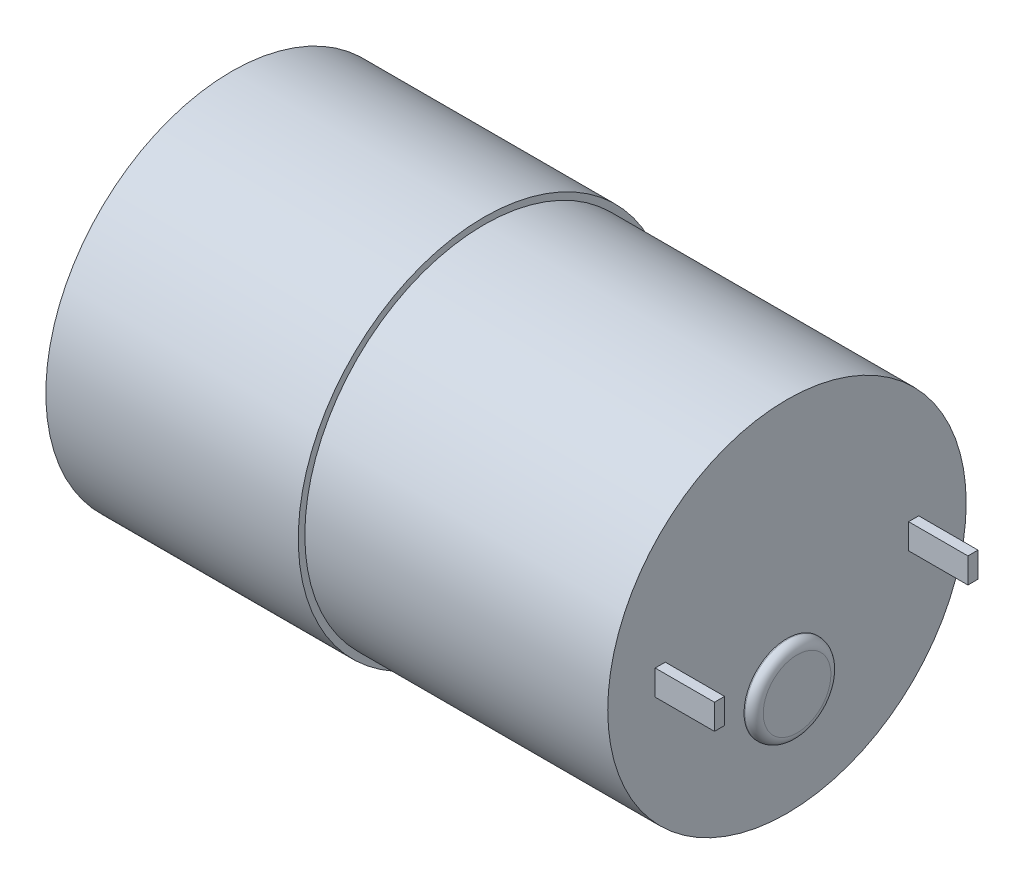
from build123d import *

# Parameters (mm, degrees)
SKETCH2_R                      = 4.25
BOSS_EXTRUDE1_DEPTH            = 1
FILLET1_R                      = 0.9
CHAMFER1_SIZE                  = 1.65
M3X0_5_TAPPED_HOLE2_AT_2_COUNT = 2
M3X0_5_TAPPED_HOLE2_AT_2_PITCH = 15.5
M3X0_5_TAPPED_HOLE2_AT_3_COUNT = 2
M3X0_5_TAPPED_HOLE2_AT_3_PITCH = 21.920310217
M3X0_5_TAPPED_HOLE2_AT_4_COUNT = 2
M3X0_5_TAPPED_HOLE2_AT_4_PITCH = 26.846787517
M3X0_5_TAPPED_HOLE2_AT_5_COUNT = 2
M3X0_5_TAPPED_HOLE2_AT_5_PITCH = 31
M3X0_5_TAPPED_HOLE2_AT_6_COUNT = 2
M3X0_5_TAPPED_HOLE2_AT_6_PITCH = 29.943700615
M3X0_5_TAPPED_HOLE2_AT_7_COUNT = 2
M3X0_5_TAPPED_HOLE2_AT_7_PITCH = 26.846787517
M3X0_5_TAPPED_HOLE2_AT_8_COUNT = 2
M3X0_5_TAPPED_HOLE2_AT_8_PITCH = 15.5
M3X0_5_TAPPED_HOLE2_AT_9_COUNT = 2
M3X0_5_TAPPED_HOLE2_AT_9_PITCH = 8.023390398
CUT_EXTRUDE3_DEPTH             = 1
SKETCH12_W                     = 1
SKETCH12_H                     = 2.5
BOSS_EXTRUDE3_DEPTH            = 5.87


with BuildPart() as part:
    # Sketch1 → Revolve1 (revolve)
    with BuildSketch(Plane.XY, mode=Mode.PRIVATE) as revolve1_sk:
        Polygon((30, 0), (30, 17.75), (0, 17.75), (0, 18.4), (-25, 18.4), (-25, 0), align=None)
    revolve(revolve1_sk.sketch.rotate(Axis((-25, 0, 0), (1, 0, 0)), 180), axis=Axis((-25, 0, 0), (1, 0, 0)))

    # Sketch2 → Boss-Extrude1 (add)
    with BuildSketch(Plane(origin=(30, 0, 0), x_dir=(0, 0, -1), z_dir=(1, 0, 0))):
        with Locations(Location((0, -7, 0), (0, 0, 270))):
            Circle(SKETCH2_R)
    extrude(amount=BOSS_EXTRUDE1_DEPTH)

    # Fillet1
    fillet1_edges = [part.edges().sort_by_distance(p)[0] for p in [
        (31, -2.75, 0),
    ]]
    fillet(fillet1_edges, radius=FILLET1_R)

    # Sketch11 → M3x0.5 Tapped Hole2 (revolve, cut)
    with BuildSketch(Plane(origin=(-25, 0, -15.5), x_dir=(0, 0, 1), z_dir=(0, 1, 0))):
        Polygon((0, 0), (0, 1.751075774), (1.25, 1), (1.25, 0), align=None)
    m3x0_5_tapped_hole2 = revolve(axis=Axis((-31.35, 0, -15.5), (1, 0, 0)), mode=Mode.SUBTRACT)

    # M3x0.5 Tapped Hole2 at 2: M3x0.5 Tapped Hole2 ×2
    with Locations(*[Vector(0, 0.8660254037844387, 0.5000000000000001) * (i * M3X0_5_TAPPED_HOLE2_AT_2_PITCH) for i in range(1, M3X0_5_TAPPED_HOLE2_AT_2_COUNT)]):
        add(m3x0_5_tapped_hole2, mode=Mode.SUBTRACT)

    # M3x0.5 Tapped Hole2 at 3: M3x0.5 Tapped Hole2 ×2
    with Locations(*[Vector(0, 0.7071067811865476, 0.7071067811865475) * (i * M3X0_5_TAPPED_HOLE2_AT_3_PITCH) for i in range(1, M3X0_5_TAPPED_HOLE2_AT_3_COUNT)]):
        add(m3x0_5_tapped_hole2, mode=Mode.SUBTRACT)

    # M3x0.5 Tapped Hole2 at 4: M3x0.5 Tapped Hole2 ×2
    with Locations(*[Vector(0, 0.5000000000000182, 0.8660254037844283) * (i * M3X0_5_TAPPED_HOLE2_AT_4_PITCH) for i in range(1, M3X0_5_TAPPED_HOLE2_AT_4_COUNT)]):
        add(m3x0_5_tapped_hole2, mode=Mode.SUBTRACT)

    # M3x0.5 Tapped Hole2 at 5: M3x0.5 Tapped Hole2 ×2
    with Locations(*[(0, 0, i * M3X0_5_TAPPED_HOLE2_AT_5_PITCH) for i in range(1, M3X0_5_TAPPED_HOLE2_AT_5_COUNT)]):
        add(m3x0_5_tapped_hole2, mode=Mode.SUBTRACT)

    # M3x0.5 Tapped Hole2 at 6: M3x0.5 Tapped Hole2 ×2
    with Locations(*[Vector(0, -0.25881904510249465, 0.9659258262890753) * (i * M3X0_5_TAPPED_HOLE2_AT_6_PITCH) for i in range(1, M3X0_5_TAPPED_HOLE2_AT_6_COUNT)]):
        add(m3x0_5_tapped_hole2, mode=Mode.SUBTRACT)

    # M3x0.5 Tapped Hole2 at 7: M3x0.5 Tapped Hole2 ×2
    with Locations(*[Vector(0, -0.49999999999998174, 0.8660254037844493) * (i * M3X0_5_TAPPED_HOLE2_AT_7_PITCH) for i in range(1, M3X0_5_TAPPED_HOLE2_AT_7_COUNT)]):
        add(m3x0_5_tapped_hole2, mode=Mode.SUBTRACT)

    # M3x0.5 Tapped Hole2 at 8: M3x0.5 Tapped Hole2 ×2
    with Locations(*[Vector(0, -0.8660254037844072, 0.5000000000000545) * (i * M3X0_5_TAPPED_HOLE2_AT_8_PITCH) for i in range(1, M3X0_5_TAPPED_HOLE2_AT_8_COUNT)]):
        add(m3x0_5_tapped_hole2, mode=Mode.SUBTRACT)

    # M3x0.5 Tapped Hole2 at 9: M3x0.5 Tapped Hole2 ×2
    with Locations(*[Vector(0, -0.9659258262890423, 0.25881904510261794) * (i * M3X0_5_TAPPED_HOLE2_AT_9_PITCH) for i in range(1, M3X0_5_TAPPED_HOLE2_AT_9_COUNT)]):
        add(m3x0_5_tapped_hole2, mode=Mode.SUBTRACT)

    # Sketch7 → Cut-Extrude3 (cut)
    with BuildSketch(Plane.ZY.offset(25)):
        with BuildLine():
            ThreePointArc((-9.685169074, -7), (0, 11.95), (9.685169074, -7))
            add(Edge.make_bspline(
                [(8.58, -7), (8.659297907, -7.987769276), (9.685169074, -7)],
                knots=[0, 0, 0, 1, 1, 1], degree=2))
            ThreePointArc((8.58, -7), (0, 1.58), (-8.58, -7))
            add(Edge.make_bspline(
                [(-9.685169074, -7), (-8.659297907, -7.987769276), (-8.58, -7)],
                knots=[0, 0, 0, 1, 1, 1], degree=2))
        make_face()
    extrude(amount=-CUT_EXTRUDE3_DEPTH, mode=Mode.SUBTRACT)

    # Sketch12 → Boss-Extrude3 (add)
    with BuildSketch(Plane(origin=(30, 0, 0), x_dir=(0, 0, -1), z_dir=(1, 0, 0))):
        with Locations((12.55, 0)):
            Rectangle(SKETCH12_W, SKETCH12_H)
        with Locations((-12.55, 0)):
            Rectangle(SKETCH12_W, SKETCH12_H)
    extrude(amount=BOSS_EXTRUDE3_DEPTH)


with BuildPart() as body_2:
    # Sketch4 → Revolve2 (revolve)
    with BuildSketch(Plane.XY, mode=Mode.PRIVATE) as revolve2_sk:
        Polygon((-20.034069856, -7), (-26.5, -7), (-26.5, -4), (-31.5, -4), (-31.5, -1), (-25, -1), align=None)
    revolve(revolve2_sk.sketch.rotate(Axis((30.1, -7, 0), (-1, 0, 0)), 90), axis=Axis((30.1, -7, 0), (-1, 0, 0)))

    # Chamfer1
    chamfer1_edges = [body_2.edges().sort_by_distance(p)[0] for p in [
        (-31.5, -7, 6),
    ]]
    chamfer(chamfer1_edges, length=CHAMFER1_SIZE)


solid = Compound([part.part, body_2.part])
